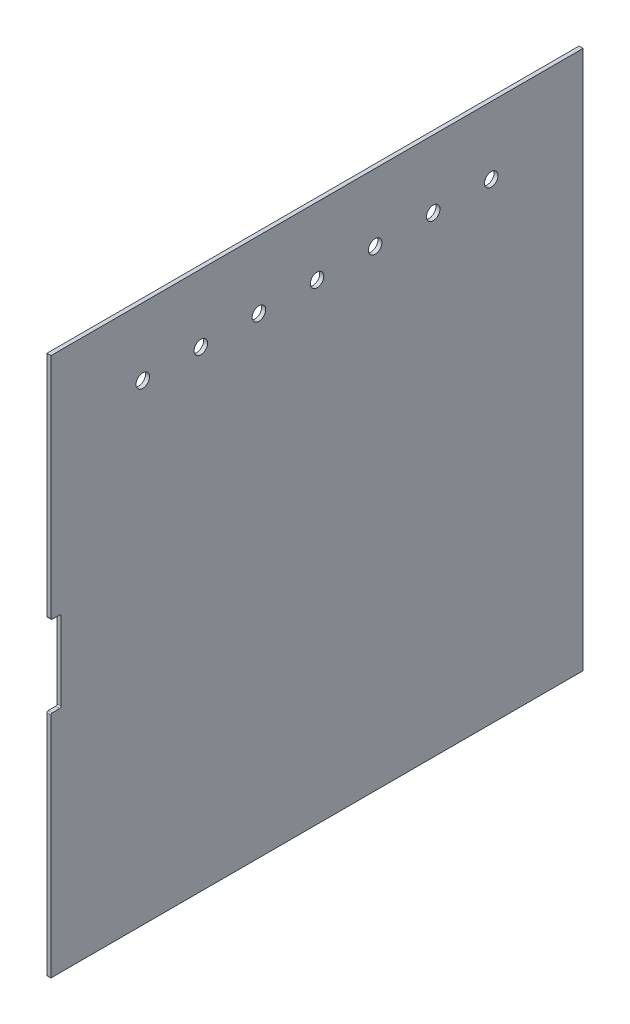
from build123d import *

# Parameters (mm, degrees)
SKETCH_1_W          = 394
SKETCH_1_H          = 399
EXTRUDE_1_DEPTH     = 3
SKETCH_2_R          = 5
SKETCH_2_W          = 7.5
SKETCH_2_H          = 60
CUT_EXTRUDE_1_DEPTH = 281.389461286
FILLET_1_R          = 1


with BuildPart() as part:
    # 草圖1 → 填料-伸長1 (new body)
    with BuildSketch(Plane(origin=(0, 0, 0), x_dir=(0, 0, -1), z_dir=(1, 0, 0))):
        Rectangle(SKETCH_1_W, SKETCH_1_H)
    extrude(amount=EXTRUDE_1_DEPTH)

    # 草圖2 → 除料-伸長1 (cut, through all)
    with BuildSketch(Plane(origin=(3, 0, 0), x_dir=(0, 0, -1), z_dir=(1, 0, 0))):
        with Locations((-129, 149.5)):
            Circle(SKETCH_2_R)
        with Locations((-86, 149.5)):
            Circle(SKETCH_2_R)
        with Locations((-43, 149.5)):
            Circle(SKETCH_2_R)
        with Locations((0, 149.5)):
            Circle(SKETCH_2_R)
        with Locations((43, 149.5)):
            Circle(SKETCH_2_R)
        with Locations((86, 149.5)):
            Circle(SKETCH_2_R)
        with Locations((129, 149.5)):
            Circle(SKETCH_2_R)
        with Locations((-193.25, 0)):
            Rectangle(SKETCH_2_W, SKETCH_2_H)
    extrude(amount=-CUT_EXTRUDE_1_DEPTH, mode=Mode.SUBTRACT)

    # 圓角1
    fillet_1_edges = [part.edges().sort_by_distance(p)[0] for p in [
        (1.5, -30, 197),
        (1.5, 30, 197),
        (1.5, 30, 189.5),
        (1.5, -30, 189.5),
    ]]
    fillet(fillet_1_edges, radius=FILLET_1_R)


solid = part.part
